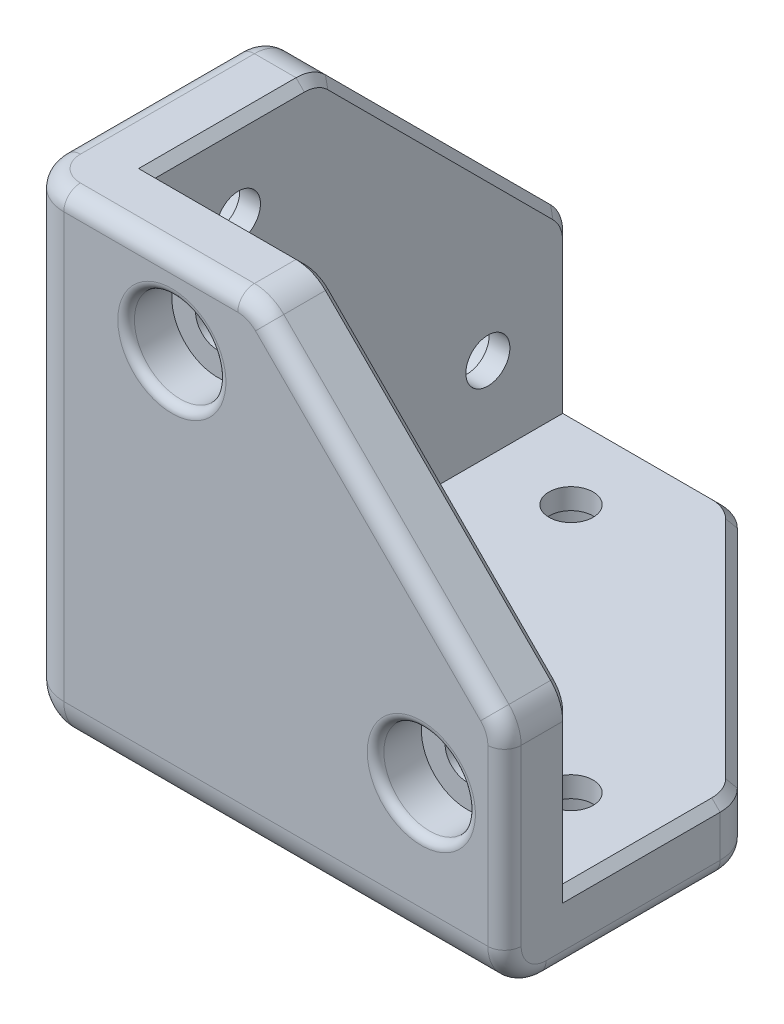
from build123d import *

# Parameters (mm, degrees)
SKETCH1_W           = 58
SKETCH1_H           = 58
BOSS_EXTRUDE1_DEPTH = 58
SKETCH3_W           = 50
SKETCH3_H           = 50
CUT_EXTRUDE1_DEPTH  = 50
CUT_EXTRUDE2_DEPTH  = 8
CUT_EXTRUDE3_DEPTH  = 8
CUT_EXTRUDE4_DEPTH  = 8
FILLET1_R           = 5
SKETCH10_R          = 2.65
CUT_EXTRUDE5_DEPTH  = 8
SKETCH11_R          = 2.65
CUT_EXTRUDE6_DEPTH  = 8
SKETCH12_R          = 2.65
CUT_EXTRUDE7_DEPTH  = 8
SKETCH13_R          = 5.5
CUT_EXTRUDE8_DEPTH  = 5.5
SKETCH14_R          = 5.5
CUT_EXTRUDE9_DEPTH  = 5.5
SKETCH15_R          = 5.5
CUT_EXTRUDE10_DEPTH = 5.5
FILLET2_R           = 1
FILLET3_R           = 2
CHAMFER1_SIZE       = 1


with BuildPart() as part:
    # Sketch1 → Boss-Extrude1 (new body)
    with BuildSketch(Plane(origin=(0, 0, 0), x_dir=(1, 0, 0), z_dir=(0, 1, 0))):
        Rectangle(SKETCH1_W, SKETCH1_H)
    extrude(amount=BOSS_EXTRUDE1_DEPTH)

    # Sketch3 → Cut-Extrude1 (cut)
    with BuildSketch(Plane(origin=(0, 58, 0), x_dir=(1, 0, 0), z_dir=(0, 1, 0))):
        with Locations((4, 4)):
            Rectangle(SKETCH3_W, SKETCH3_H)
    extrude(amount=-CUT_EXTRUDE1_DEPTH, mode=Mode.SUBTRACT)

    # Sketch4 → Cut-Extrude2 (cut)
    with BuildSketch(Plane(origin=(0, 0, 21), x_dir=(-1, 0, 0), z_dir=(0, 0, -1))):
        Polygon((-29, 28), (1, 58), (-29, 58), align=None)
    extrude(amount=-CUT_EXTRUDE2_DEPTH, mode=Mode.SUBTRACT)

    # Sketch5 → Cut-Extrude3 (cut)
    with BuildSketch(Plane(origin=(-21, 0, 0), x_dir=(0, 0, -1), z_dir=(1, 0, 0))):
        Polygon((-1, 58), (29, 28), (29, 58), align=None)
    extrude(amount=-CUT_EXTRUDE3_DEPTH, mode=Mode.SUBTRACT)

    # Sketch6 → Cut-Extrude4 (cut)
    with BuildSketch(Plane(origin=(0, 8, 0), x_dir=(1, 0, 0), z_dir=(0, 1, 0))):
        Polygon((-1, 29), (29, -1), (29, 29), align=None)
    extrude(amount=-CUT_EXTRUDE4_DEPTH, mode=Mode.SUBTRACT)

    # Fillet1
    fillet1_edges = [part.edges().sort_by_distance(p)[0] for p in [
        (29, 28, 25),
        (-1, 58, 25),
        (-25, 58, 1),
        (-25, 28, -29),
        (0, 0, 29),
        (-1, 4, -29),
        (29, 4, 1),
        (-29, 0, 0),
        (-29, 29, 29),
    ]]
    fillet(fillet1_edges, radius=FILLET1_R)

    # Sketch10 → Cut-Extrude5 (cut)
    with BuildSketch(Plane.XY.offset(29)):
        with Locations((19, 18)):
            Circle(SKETCH10_R)
        with Locations(Location((-11, 48, 0), (0, 0, 180))):
            Circle(SKETCH10_R)
    extrude(amount=-CUT_EXTRUDE5_DEPTH, mode=Mode.SUBTRACT)

    # Sketch11 → Cut-Extrude6 (cut)
    with BuildSketch(Plane.ZY.offset(29)):
        with Locations((-19, 18)):
            Circle(SKETCH11_R)
        with Locations(Location((11, 48, 0), (0, 0, 180))):
            Circle(SKETCH11_R)
    extrude(amount=-CUT_EXTRUDE6_DEPTH, mode=Mode.SUBTRACT)

    # Sketch12 → Cut-Extrude7 (cut)
    with BuildSketch(Plane.XZ):
        with Locations(Location((-11, -19, 0), (0, 0, 270))):
            Circle(SKETCH12_R)
        with Locations(Location((19, 11, 0), (0, 0, 270))):
            Circle(SKETCH12_R)
    extrude(amount=-CUT_EXTRUDE7_DEPTH, mode=Mode.SUBTRACT)

    # Sketch13 → Cut-Extrude8 (cut)
    with BuildSketch(Plane(origin=(0, 5.5, 0), x_dir=(1, 0, 0), z_dir=(0, 1, 0))):
        with Locations(Location((-11, 19, 0), (0, 0, 270))):
            Circle(SKETCH13_R)
        with Locations(Location((19, -11, 0), (0, 0, 270))):
            Circle(SKETCH13_R)
    extrude(amount=-CUT_EXTRUDE8_DEPTH, mode=Mode.SUBTRACT)

    # Sketch14 → Cut-Extrude9 (cut)
    with BuildSketch(Plane.ZY.offset(29)):
        with Locations((-19, 18)):
            Circle(SKETCH14_R)
        with Locations((11, 48)):
            Circle(SKETCH14_R)
    extrude(amount=-CUT_EXTRUDE9_DEPTH, mode=Mode.SUBTRACT)

    # Sketch15 → Cut-Extrude10 (cut)
    with BuildSketch(Plane.XY.offset(29)):
        with Locations((-11, 48)):
            Circle(SKETCH15_R)
        with Locations((19, 18)):
            Circle(SKETCH15_R)
    extrude(amount=-CUT_EXTRUDE10_DEPTH, mode=Mode.SUBTRACT)

    # Fillet2
    fillet2_edges = [part.edges().sort_by_distance(p)[0] for p in [
        (-11, 0, -24.5),
        (19, 0, 5.5),
        (-29, 18, -24.5),
        (-29, 48, 5.5),
        (-16.5, 48, 29),
        (13.5, 18, 29),
    ]]
    fillet(fillet2_edges, radius=FILLET2_R)

    # Fillet3
    fillet3_edges = [part.edges().sort_by_distance(p)[0] for p in [
        (14, 0, -14),
        (-13.535533906, 0, -29),
        (-29, 15.464466094, -29),
        (-27.535533906, 1.464466094, -29),
        (29, 0, 13.535533906),
        (28.619397663, 0, 1.15765065),
        (-1.15765065, 0, -28.619397663),
        (29, 15.464466094, 29),
        (29, 1.464466094, 27.535533906),
        (-29, 43, -14),
        (-29, 58, 13.535533906),
        (-13.535533906, 58, 29),
        (-27.535533906, 58, 27.535533906),
        (-29, 27.84234935, -28.619397663),
        (-29, 57.619397663, 1.15765065),
        (14, 43, 29),
        (28.619397663, 27.84234935, 29),
        (-1.15765065, 57.619397663, 29),
    ]]
    fillet(fillet3_edges, radius=FILLET3_R)

    # Chamfer1
    chamfer1_edges = [part.edges().sort_by_distance(p)[0] for p in [
        (-21, 16.964466094, -29),
        (29, 8, 12.035533906),
        (29, 16.964466094, 21),
        (-12.035533906, 58, 21),
        (14, 8, -14),
        (-12.035533906, 8, -29),
        (28.619397663, 8, 1.15765065),
        (-1.15765065, 8, -28.619397663),
        (-21, 43, -14),
        (-21, 58, 12.035533906),
        (-21, 27.84234935, -28.619397663),
        (-21, 57.619397663, 1.15765065),
        (14, 43, 21),
        (28.619397663, 27.84234935, 21),
        (-1.15765065, 57.619397663, 21),
    ]]
    chamfer(chamfer1_edges, length=CHAMFER1_SIZE)


solid = part.part
